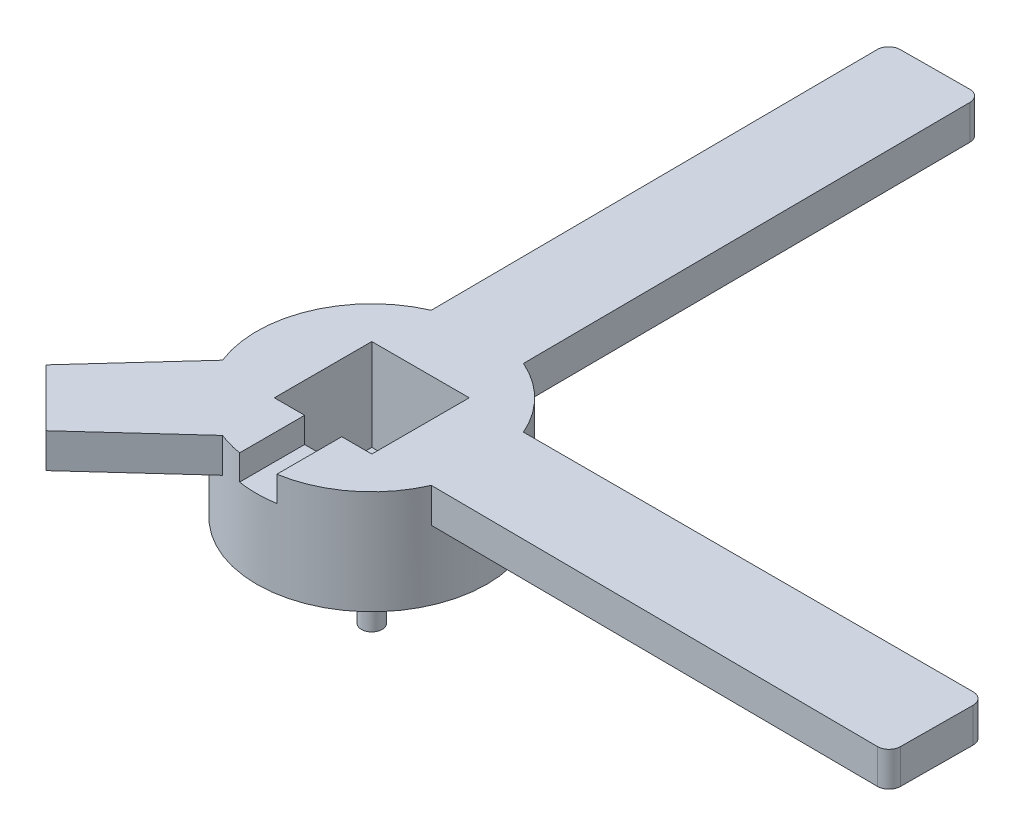
from build123d import *

# Parameters (mm, degrees)
SKETCH4_R           = 50
BOSS_EXTRUDE3_DEPTH = 45.1
SKETCH16_R          = 4.5
BOSS_EXTRUDE5_DEPTH = 15
CUT_EXTRUDE1_DEPTH  = 39.8
SKETCH7_W           = 16.113230219
SKETCH7_H           = 35.470323835
CUT_EXTRUDE3_DEPTH  = 11
SKETCH8_R           = 11.15
SKETCH8_R_2         = 1.65
CUT_EXTRUDE4_DEPTH  = 5.3
SKETCH9_R           = 2.9
CUT_EXTRUDE5_DEPTH  = 3.2
BOSS_EXTRUDE4_DEPTH = 15


with BuildPart() as part:
    # Sketch4 → Boss-Extrude3 (new body)
    with BuildSketch(Plane(origin=(0, 39.8, 0), x_dir=(1, 0, 0), z_dir=(0, 1, 0))):
        with Locations((-8.113230219, -47.62731131)):
            Circle(SKETCH4_R)
    extrude(amount=-BOSS_EXTRUDE3_DEPTH)

    # Sketch16 → Boss-Extrude5 (add)
    with BuildSketch(Plane.XZ.offset(5.3)):
        with Locations((-8.113230219, 21.53731131)):
            Circle(SKETCH16_R)
        with Locations((17.976769781, 47.62731131)):
            Circle(SKETCH16_R)
        with Locations((-8.113230219, 73.71731131)):
            Circle(SKETCH16_R)
        with Locations((-34.203230219, 47.62731131)):
            Circle(SKETCH16_R)
        with Locations((-32.86196756, 22.878573969)):
            Circle(SKETCH16_R)
        with Locations((16.635507123, 22.878573969)):
            Circle(SKETCH16_R)
        with Locations((16.635507123, 72.376048652)):
            Circle(SKETCH16_R)
        with Locations((-32.86196756, 72.376048652)):
            Circle(SKETCH16_R)
    extrude(amount=BOSS_EXTRUDE5_DEPTH)

    # Sketch5 → Cut-Extrude1 (cut)
    with BuildSketch(Plane(origin=(0, 39.8, 0), x_dir=(1, 0, 0), z_dir=(0, 1, 0))):
        Polygon((13.036769781, -26.47731131), (-29.263230219, -26.47731131), (-29.263230219, -68.77731131), (-16.113230219, -68.77731131), (-0.113230219, -68.77731131), (13.036769781, -68.77731131), align=None)
    extrude(amount=-CUT_EXTRUDE1_DEPTH, mode=Mode.SUBTRACT)

    # Sketch7 → Cut-Extrude3 (cut)
    with BuildSketch(Plane(origin=(0, 39.8, 0), x_dir=(1, 0, 0), z_dir=(0, 1, 0))):
        with Locations((-8.05661511, -86.512473228)):
            Rectangle(SKETCH7_W, SKETCH7_H)
    extrude(amount=-CUT_EXTRUDE3_DEPTH, mode=Mode.SUBTRACT)

    # Sketch8 → Cut-Extrude4 (cut)
    with BuildSketch(Plane(origin=(0, 0, 0), x_dir=(1, 0, 0), z_dir=(0, 1, 0))):
        with Locations((-8.113230219, -47.62731131)):
            Circle(SKETCH8_R)
        with Locations((7.386769781, -32.12731131)):
            Circle(SKETCH8_R_2)
        with Locations((7.386769781, -63.12731131)):
            Circle(SKETCH8_R_2)
        with Locations((-23.613230219, -63.12731131)):
            Circle(SKETCH8_R_2)
        with Locations((-23.613230219, -32.12731131)):
            Circle(SKETCH8_R_2)
    extrude(amount=-CUT_EXTRUDE4_DEPTH, mode=Mode.SUBTRACT)

    # Sketch9 → Cut-Extrude5 (cut)
    with BuildSketch(Plane.XZ.offset(5.3)):
        with Locations((-23.613230219, 32.12731131)):
            Circle(SKETCH9_R)
        with Locations((-23.613230219, 63.12731131)):
            Circle(SKETCH9_R)
        with Locations((7.386769781, 63.12731131)):
            Circle(SKETCH9_R)
        with Locations((7.386769781, 32.12731131)):
            Circle(SKETCH9_R)
    extrude(amount=-CUT_EXTRUDE5_DEPTH, mode=Mode.SUBTRACT)

    # Sketch11 → Boss-Extrude4 (add)
    with BuildSketch(Plane(origin=(0, 39.8, 0), x_dir=(1, 0, 0), z_dir=(0, 1, 0))):
        with BuildLine():
            Line((232.962144958, -27.62731131), (37.712526731, -27.62731131))
            ThreePointArc((37.712526731, -27.62731131), (41.886769781, -47.62731131), (37.712526731, -67.62731131))
            Line((37.712526731, -67.62731131), (232.707755381, -68.991424164))
            ThreePointArc((232.707755381, -68.991424164), (236.253447378, -67.551726556), (237.742610291, -64.026523759))
            Line((237.742610291, -64.026523759), (237.962022615, -32.662288563))
            ThreePointArc((237.962022615, -32.662288563), (236.510023638, -29.104165434), (232.962144958, -27.62731131))
        make_face()
        with BuildLine():
            Line((-29.345351576, 192.94147664), (-28.113230219, -1.801554361))
            ThreePointArc((-28.113230219, -1.801554361), (-8.113230219, 2.37268869), (11.886769781, -1.801554361))
            Line((11.886769781, -1.801554361), (10.653047297, 193.194542854))
            ThreePointArc((10.653047297, 193.194542854), (9.166241961, 196.720740641), (5.621513459, 198.162808872))
            Line((5.621513459, 198.162808872), (-24.377085557, 197.973010478))
            ThreePointArc((-24.377085557, 197.973010478), (-27.903283344, 196.486205142), (-29.345351576, 192.94147664))
        make_face()
        with BuildLine():
            ThreePointArc((-26.374798087, -94.173150426), (-43.468569278, -82.98265037), (-54.659069334, -65.888879179))
            Line((-54.659069334, -65.888879179), (-91.198277008, -105.963620758))
            Line((-91.198277008, -105.963620758), (-66.449539667, -130.7123581))
            Line((-66.449539667, -130.7123581), (-26.374798087, -94.173150426))
        make_face()
    extrude(amount=-BOSS_EXTRUDE4_DEPTH)


solid = part.part
